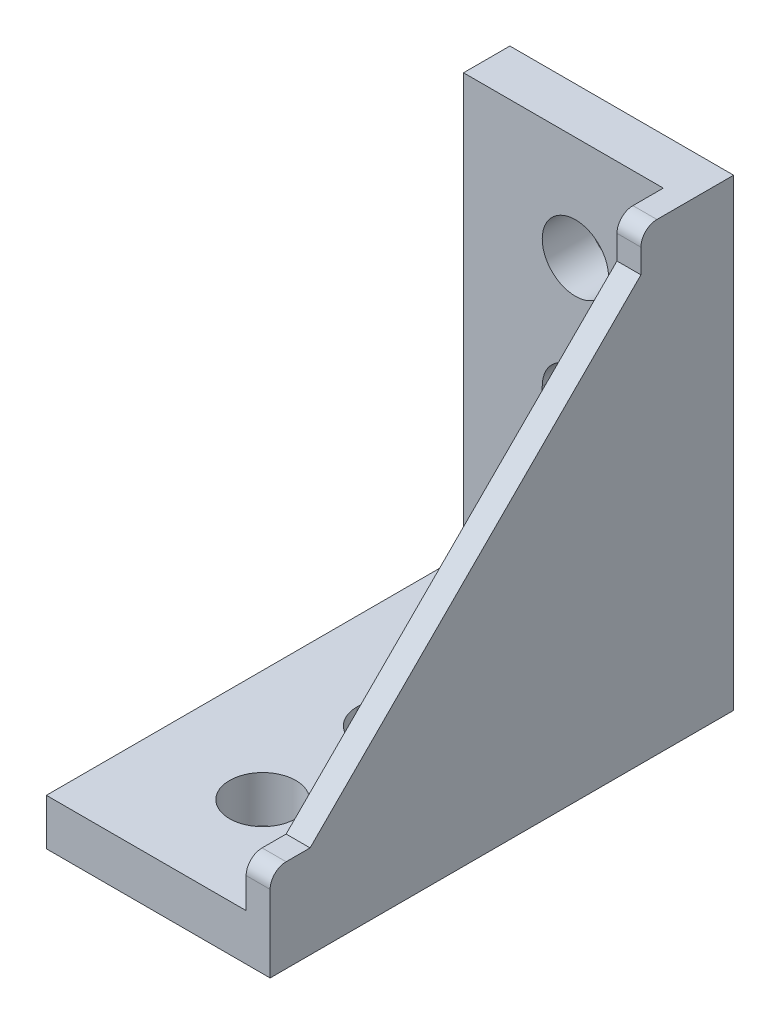
from build123d import *

# Parameters (mm, degrees)
SKETCH_1_W          = 28
SKETCH_1_H          = 58
EXTRUDE_1_DEPTH     = 5.8
SKETCH_2_W          = 28
SKETCH_2_H          = 5.8
EXTRUDE_2_DEPTH     = 58
EXTRUDE_3_DEPTH     = 3
FILLET_1_R          = 2
SKETCH_4_R          = 4.15
CUT_EXTRUDE_1_DEPTH = 80.276982788


with BuildPart() as part:
    # 草图1 → 凸台-拉伸1 (new body)
    with BuildSketch(Plane.XY):
        Rectangle(SKETCH_1_W, SKETCH_1_H)
    extrude(amount=EXTRUDE_1_DEPTH)

    # 草图2 → 凸台-拉伸2 (add)
    with BuildSketch(Plane(origin=(0, 0, 0), x_dir=(-1, 0, 0), z_dir=(0, 0, -1))):
        with Locations((0, -26.1)):
            Rectangle(SKETCH_2_W, SKETCH_2_H)
    extrude(amount=-EXTRUDE_2_DEPTH)

    # 草图3 → 凸台-拉伸3 (add)
    with BuildSketch(Plane(origin=(14, 0, 0), x_dir=(0, 0, -1), z_dir=(1, 0, 0))):
        Polygon((-5.8, 29), (-11.6, 29), (-11.6, 24), (-53, -17.4), (-58, -17.4), (-58, -23.2), (-5.8, -23.2), align=None)
    extrude(amount=-EXTRUDE_3_DEPTH)

    # 圆角1
    fillet_1_edges = [part.edges().sort_by_distance(p)[0] for p in [
        (12.5, -17.4, 58),
        (12.5, 29, 11.6),
    ]]
    fillet(fillet_1_edges, radius=FILLET_1_R)

    # 草图4 → 切除-拉伸1 (cut, through all)
    with BuildSketch(Plane(origin=(0, -23.2, 0), x_dir=(1, 0, 0), z_dir=(0, 1, 0))):
        with Locations(Location((0, -44.929446332, 0), (0, 0, 180))):
            Circle(SKETCH_4_R)
        with BuildLine():
            Line((4.15, -17.270397055), (4.15, -28.970397055))
            ThreePointArc((4.15, -28.970397055), (0, -33.120397055), (-4.15, -28.970397055))
            Line((-4.15, -28.970397055), (-4.15, -17.270397055))
            ThreePointArc((-4.15, -17.270397055), (0, -13.120397055), (4.15, -17.270397055))
        make_face()
    cut_extrude_1 = extrude(amount=-CUT_EXTRUDE_1_DEPTH, mode=Mode.SUBTRACT)

    # 镜向1: 切除-拉伸1 across plane
    add(cut_extrude_1.mirror(Plane(origin=(0, -14.5, 14.5), x_dir=(0, 0.7071067811865469, 0.7071067811865482), z_dir=(0, -0.7071067811865483, 0.7071067811865468))), mode=Mode.SUBTRACT)


solid = part.part
